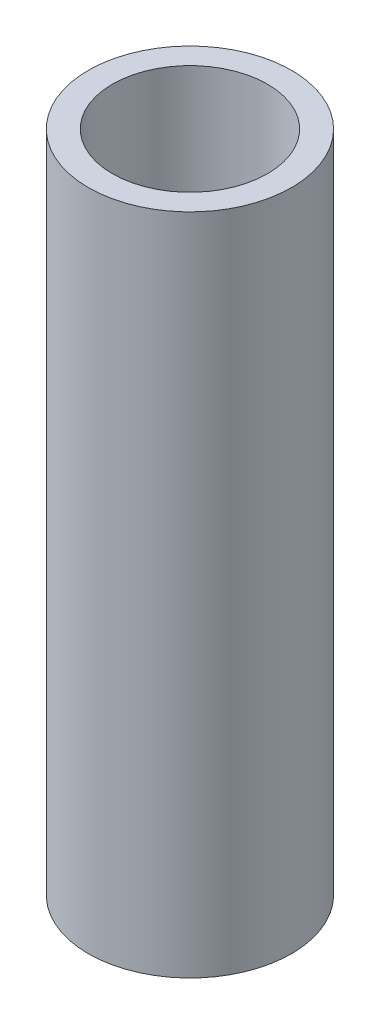
from build123d import *

# Parameters (mm, degrees)
SKETCH1_R           = 3.4925
SKETCH1_R_2         = 2.667
BOSS_EXTRUDE1_DEPTH = 22.8092


with BuildPart() as part:
    # Sketch1 → Boss-Extrude1 (new body)
    with BuildSketch(Plane(origin=(0, 0, 0), x_dir=(1, 0, 0), z_dir=(0, 1, 0))):
        with Locations(Location((0, 0, 0), (0, 0, 270))):
            Circle(SKETCH1_R)
        with Locations(Location((0, 0, 0), (0, 0, 270))):
            Circle(SKETCH1_R_2, mode=Mode.SUBTRACT)
    extrude(amount=BOSS_EXTRUDE1_DEPTH)


solid = part.part
